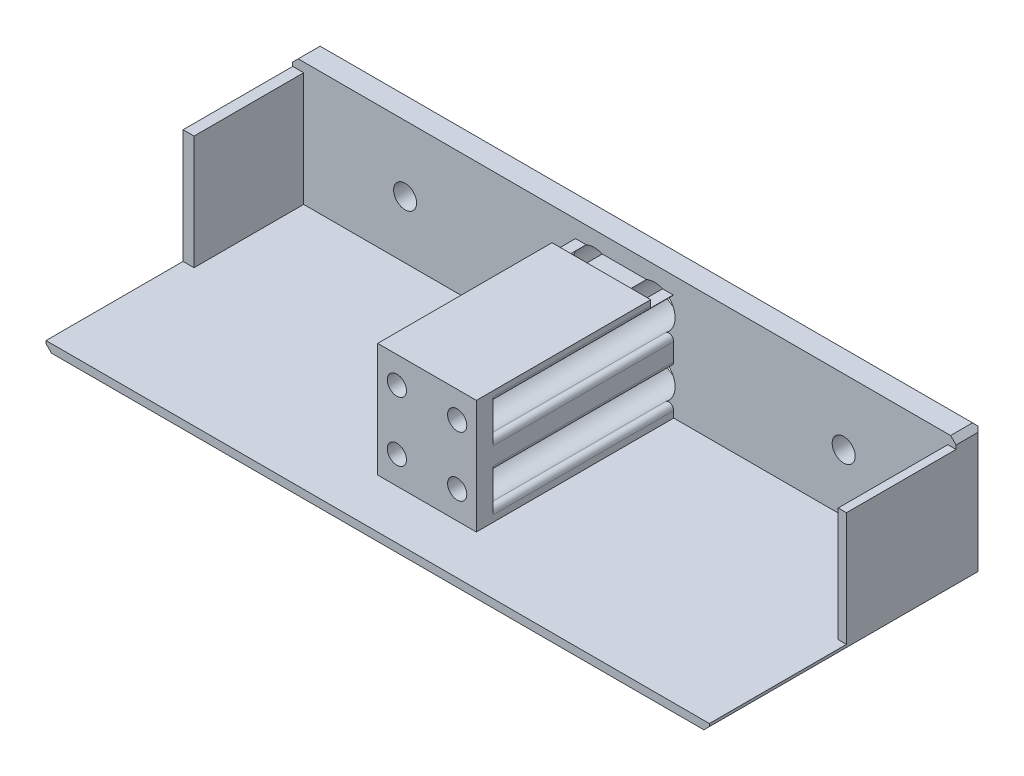
from build123d import *

# Parameters (mm, degrees)
SZKIC1_W                    = 121
SZKIC1_H                    = 24
SZKIC1_R                    = 2.1
DODANIE_WYCI_GNI_CIE1_DEPTH = 5
SZKIC2_W                    = 18
SZKIC2_H                    = 21
DODANIE_WYCI_GNI_CIE2_DEPTH = 36
WYTNIJ_WYCI_GNI_CIE1_REACH  = 76.062
SZKIC3_R                    = 1.75
SZKIC4_R                    = 3.75
WYTNIJ_WYCI_GNI_CIE2_DEPTH  = 38
ZAOKR_GLENIE1_R             = 0.9
SZKIC5_W                    = 121
SZKIC5_H                    = 1.5
DODANIE_WYCI_GNI_CIE3_DEPTH = 45
SZKIC6_W                    = 18
SZKIC6_H                    = 36
WYTNIJ_WYCI_GNI_CIE3_DEPTH  = 0.2
SZKIC7_W                    = 18
SZKIC7_H                    = 4.2
WYTNIJ_WYCI_GNI_CIE4_DEPTH  = 1.4
SZKIC8_W                    = 2
SZKIC8_H                    = 20
SZKIC8_W_2                  = 1.5
DODANIE_WYCI_GNI_CIE4_DEPTH = 20.8
SFAZOWANIE1_SIZE            = 1
SFAZOWANIE2_SIZE            = 1


with BuildPart() as part:
    # Szkic1 → Dodanie-wyciągnięcie1 (new body)
    with BuildSketch(Plane.XY):
        Rectangle(SZKIC1_W, SZKIC1_H)
        with Locations((-40, 0)):
            Circle(SZKIC1_R, mode=Mode.SUBTRACT)
        with Locations((40, 0)):
            Circle(SZKIC1_R, mode=Mode.SUBTRACT)
    extrude(amount=DODANIE_WYCI_GNI_CIE1_DEPTH)

    # Szkic2 → Dodanie-wyciągnięcie2 (add)
    with BuildSketch(Plane.XY.offset(5)):
        Rectangle(SZKIC2_W, SZKIC2_H)
    extrude(amount=DODANIE_WYCI_GNI_CIE2_DEPTH)

    # Szkic3 → Wytnij-wyciągnięcie1 (cut, up to next)
    with BuildSketch(Plane.XY.offset(41), mode=Mode.PRIVATE) as wytnij_wyci_gni_cie1_sk1:
        with Locations((-5.5, 5.45)):
            Circle(SZKIC3_R)
    wytnij_wyci_gni_cie1_tool1 = extrude(wytnij_wyci_gni_cie1_sk1.sketch, amount=-WYTNIJ_WYCI_GNI_CIE1_REACH, mode=Mode.PRIVATE) & part.part
    # Szkic3 → Wytnij-wyciągnięcie1 (cut, up to next)
    with BuildSketch(Plane.XY.offset(41), mode=Mode.PRIVATE) as wytnij_wyci_gni_cie1_sk2:
        with Locations((-5.5, -5.45)):
            Circle(SZKIC3_R)
    wytnij_wyci_gni_cie1_tool2 = extrude(wytnij_wyci_gni_cie1_sk2.sketch, amount=-WYTNIJ_WYCI_GNI_CIE1_REACH, mode=Mode.PRIVATE) & part.part
    # Szkic3 → Wytnij-wyciągnięcie1 (cut, up to next)
    with BuildSketch(Plane.XY.offset(41), mode=Mode.PRIVATE) as wytnij_wyci_gni_cie1_sk3:
        with Locations((5.5, -5.45)):
            Circle(SZKIC3_R)
    wytnij_wyci_gni_cie1_tool3 = extrude(wytnij_wyci_gni_cie1_sk3.sketch, amount=-WYTNIJ_WYCI_GNI_CIE1_REACH, mode=Mode.PRIVATE) & part.part
    # Szkic3 → Wytnij-wyciągnięcie1 (cut, up to next)
    with BuildSketch(Plane.XY.offset(41), mode=Mode.PRIVATE) as wytnij_wyci_gni_cie1_sk4:
        with Locations((5.5, 5.45)):
            Circle(SZKIC3_R)
    wytnij_wyci_gni_cie1_tool4 = extrude(wytnij_wyci_gni_cie1_sk4.sketch, amount=-WYTNIJ_WYCI_GNI_CIE1_REACH, mode=Mode.PRIVATE) & part.part
    add(wytnij_wyci_gni_cie1_tool1.solids().sort_by_distance((-5.5, 5.45, 41))[0], mode=Mode.SUBTRACT)
    add(wytnij_wyci_gni_cie1_tool2.solids().sort_by_distance((-5.5, -5.45, 41))[0], mode=Mode.SUBTRACT)
    add(wytnij_wyci_gni_cie1_tool3.solids().sort_by_distance((5.5, -5.45, 41))[0], mode=Mode.SUBTRACT)
    add(wytnij_wyci_gni_cie1_tool4.solids().sort_by_distance((5.5, 5.45, 41))[0], mode=Mode.SUBTRACT)

    # Szkic4 → Wytnij-wyciągnięcie2 (cut)
    with BuildSketch(Plane(origin=(0, 0, 0), x_dir=(-1, 0, 0), z_dir=(0, 0, -1))):
        with Locations((-5.5, 5.45)):
            Circle(SZKIC4_R)
        with Locations((-5.5, -5.45)):
            Circle(SZKIC4_R)
        with Locations((5.5, 5.45)):
            Circle(SZKIC4_R)
        with Locations((5.5, -5.45)):
            Circle(SZKIC4_R)
    extrude(amount=-WYTNIJ_WYCI_GNI_CIE2_DEPTH, mode=Mode.SUBTRACT)

    # Zaokrąglenie1
    zaokr_glenie1_edges = [part.edges().sort_by_distance(p)[0] for p in [
        (-9, -4.103708798, 21.5),
        (-9, -6.796291202, 21.5),
        (-9, 6.796291202, 21.5),
        (-9, 4.103708798, 21.5),
        (9, 4.103708798, 21.5),
        (9, 6.796291202, 21.5),
        (9, -6.796291202, 21.5),
        (9, -4.103708798, 21.5),
    ]]
    fillet(zaokr_glenie1_edges, radius=ZAOKR_GLENIE1_R)

    # Szkic5 → Dodanie-wyciągnięcie3 (add)
    with BuildSketch(Plane.XY.offset(5)):
        with Locations((0, -11.25)):
            Rectangle(SZKIC5_W, SZKIC5_H)
    extrude(amount=DODANIE_WYCI_GNI_CIE3_DEPTH)

    # Szkic6 → Wytnij-wyciągnięcie3 (cut)
    with BuildSketch(Plane(origin=(0, 10.5, 0), x_dir=(1, 0, 0), z_dir=(0, 1, 0))):
        with Locations((0, -23)):
            Rectangle(SZKIC6_W, SZKIC6_H)
    extrude(amount=-WYTNIJ_WYCI_GNI_CIE3_DEPTH, mode=Mode.SUBTRACT)

    # Szkic7 → Wytnij-wyciągnięcie4 (cut)
    with BuildSketch(Plane(origin=(0, 10.3, 0), x_dir=(1, 0, 0), z_dir=(0, 1, 0))):
        with Locations((0, -7.1)):
            Rectangle(SZKIC7_W, SZKIC7_H)
    extrude(amount=-WYTNIJ_WYCI_GNI_CIE4_DEPTH, mode=Mode.SUBTRACT)

    # Szkic8 → Dodanie-wyciągnięcie4 (add)
    with BuildSketch(Plane(origin=(0, -10.5, 0), x_dir=(1, 0, 0), z_dir=(0, 1, 0))):
        with Locations((-59.5, -15)):
            Rectangle(SZKIC8_W, SZKIC8_H)
        with Locations((59.75, -15)):
            Rectangle(SZKIC8_W_2, SZKIC8_H)
    extrude(amount=DODANIE_WYCI_GNI_CIE4_DEPTH)

    # Sfazowanie1
    sfazowanie1_edges = [part.edges().sort_by_distance(p)[0] for p in [
        (0, -12, 0),
        (-60.5, 0, 0),
        (0, 12, 0),
        (60.5, 0, 0),
    ]]
    chamfer(sfazowanie1_edges, length=SFAZOWANIE1_SIZE)

    # Sfazowanie2
    sfazowanie2_edges = [part.edges().sort_by_distance(p)[0] for p in [
        (60.5, -12, 25.5),
        (-60.5, -12, 25.5),
        (-60.5, 12, 3),
        (60.5, 12, 3),
    ]]
    chamfer(sfazowanie2_edges, length=SFAZOWANIE2_SIZE)


solid = part.part
